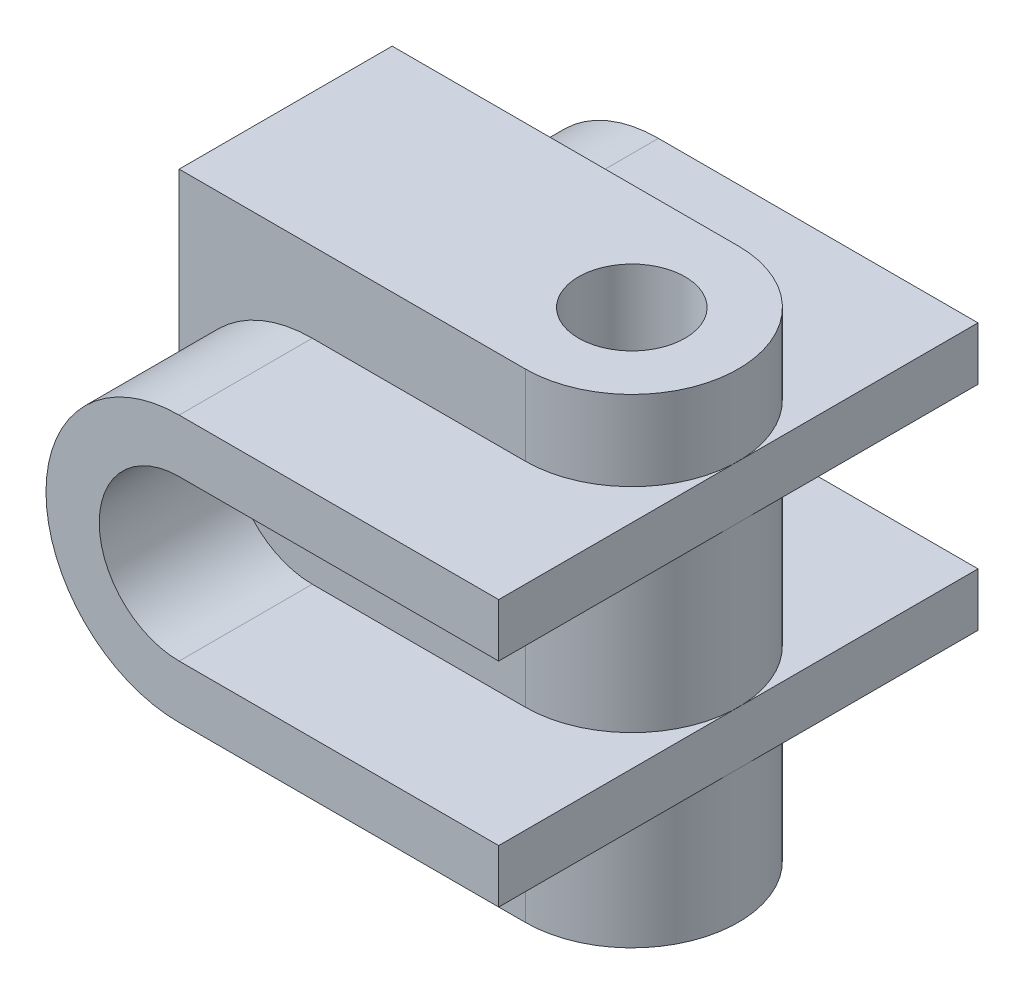
from build123d import *

# Parameters (mm, degrees)
EXTRUDE_THIN1_DEPTH = 90
SKETCH2_R           = 10
BOSS_EXTRUDE1_DEPTH = 90


with BuildPart() as part:
    # Sketch1 → Extrude-Thin1 (new body)
    with BuildSketch(Plane.XY):
        with BuildLine():
            Line((0, -15), (-60, -15))
            ThreePointArc((-60, -15), (-85, -40), (-60, -65))
            Line((-60, -65), (0, -65))
            Line((0, -65), (0, -55))
            Line((0, -55), (-60, -55))
            ThreePointArc((-60, -55), (-75, -40), (-60, -25))
            Line((-60, -25), (0, -25))
            Line((0, -25), (0, -15))
        make_face()
    extrude(amount=EXTRUDE_THIN1_DEPTH)


with BuildPart() as body_2:
    # Sketch2 → Boss-Extrude1 (new body)
    with BuildSketch(Plane(origin=(0, 0, 0), x_dir=(1, 0, 0), z_dir=(0, 1, 0))):
        with BuildLine():
            Line((-85, -25), (-85, -65))
            Line((-85, -65), (-20, -65))
            ThreePointArc((-20, -65), (0, -45), (-20, -25))
            Line((-20, -25), (-85, -25))
        make_face()
        with Locations(Location((-20, -45, 0), (0, 0, 270))):
            Circle(SKETCH2_R, mode=Mode.SUBTRACT)
    extrude(amount=-BOSS_EXTRUDE1_DEPTH)


solid = Compound([part.part, body_2.part])
